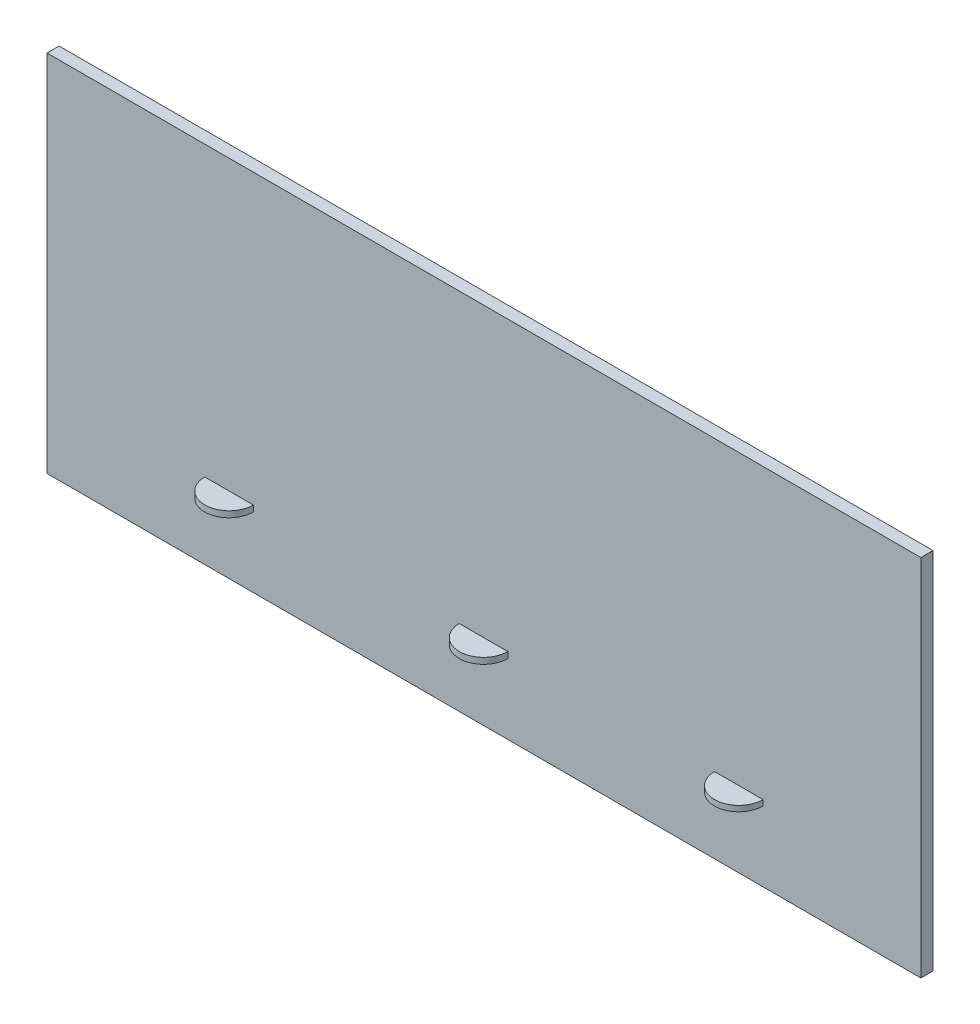
from build123d import *

# Parameters (mm, degrees)
SKETCH1_W           = 1828.8
SKETCH1_H           = 762
BOSS_EXTRUDE1_DEPTH = 25.4
BOSS_EXTRUDE2_DEPTH = 76.2
CUT_EXTRUDE2_DEPTH  = 1892.621171867
CUT_EXTRUDE3_DEPTH  = 116.84
CUT_EXTRUDE4_DEPTH  = 116.84


with BuildPart() as part:
    # Sketch1 → Boss-Extrude1 (new body)
    with BuildSketch(Plane.XY):
        with Locations((875.396405659, 338.441890904)):
            Rectangle(SKETCH1_W, SKETCH1_H)
    extrude(amount=BOSS_EXTRUDE1_DEPTH)

    # Sketch4 → Boss-Extrude2 (add)
    with BuildSketch(Plane.XY.offset(25.4)):
        Polygon((341.996405659, 116.191890904), (291.196405659, 116.191890904), (291.196405659, 103.491890904), (392.796405659, 103.491890904), (392.796405659, 116.191890904), align=None)
        Polygon((874.604865323, 116.863799968), (823.804865323, 116.863799968), (823.804865323, 104.163799968), (925.404865323, 104.163799968), (925.404865323, 116.863799968), align=None)
        Polygon((1408.796405659, 115.67295816), (1357.996405659, 115.67295816), (1357.996405659, 104.010823647), (1459.596405659, 104.010823647), (1459.596405659, 115.67295816), align=None)
    extrude(amount=BOSS_EXTRUDE2_DEPTH)

    # Sketch6 → Cut-Extrude2 (cut, through all)
    with BuildSketch(Plane(origin=(0, 115.67295816, 0), x_dir=(1, 0, 0), z_dir=(0, 1, 0))):
        with BuildLine():
            Line((1459.596405659, -25.4), (1459.596405659, -101.6))
            Line((1459.596405659, -101.6), (1357.996405659, -101.6))
            Line((1357.996405659, -101.6), (1357.996405659, -25.4))
            ThreePointArc((1357.996405659, -25.4), (1408.796405659, -76.2), (1459.596405659, -25.4))
        make_face()
    extrude(amount=-CUT_EXTRUDE2_DEPTH, mode=Mode.SUBTRACT)

    # Sketch7 → Cut-Extrude3 (cut)
    with BuildSketch(Plane(origin=(0, 116.863799968, 0), x_dir=(1, 0, 0), z_dir=(0, 1, 0))):
        with BuildLine():
            Line((925.404865323, -25.4), (925.404865323, -101.6))
            Line((925.404865323, -101.6), (823.804865323, -101.6))
            Line((823.804865323, -101.6), (823.804865323, -25.4))
            ThreePointArc((823.804865323, -25.4), (874.604865323, -76.2), (925.404865323, -25.4))
        make_face()
    extrude(amount=-CUT_EXTRUDE3_DEPTH, mode=Mode.SUBTRACT)

    # Sketch8 → Cut-Extrude4 (cut)
    with BuildSketch(Plane(origin=(0, 116.191890904, 0), x_dir=(1, 0, 0), z_dir=(0, 1, 0))):
        with BuildLine():
            Line((392.796405659, -25.4), (392.796405659, -101.6))
            Line((392.796405659, -101.6), (291.196405659, -101.6))
            Line((291.196405659, -101.6), (291.196405659, -25.4))
            ThreePointArc((291.196405659, -25.4), (341.996405659, -76.2), (392.796405659, -25.4))
        make_face()
    extrude(amount=-CUT_EXTRUDE4_DEPTH, mode=Mode.SUBTRACT)


solid = part.part
